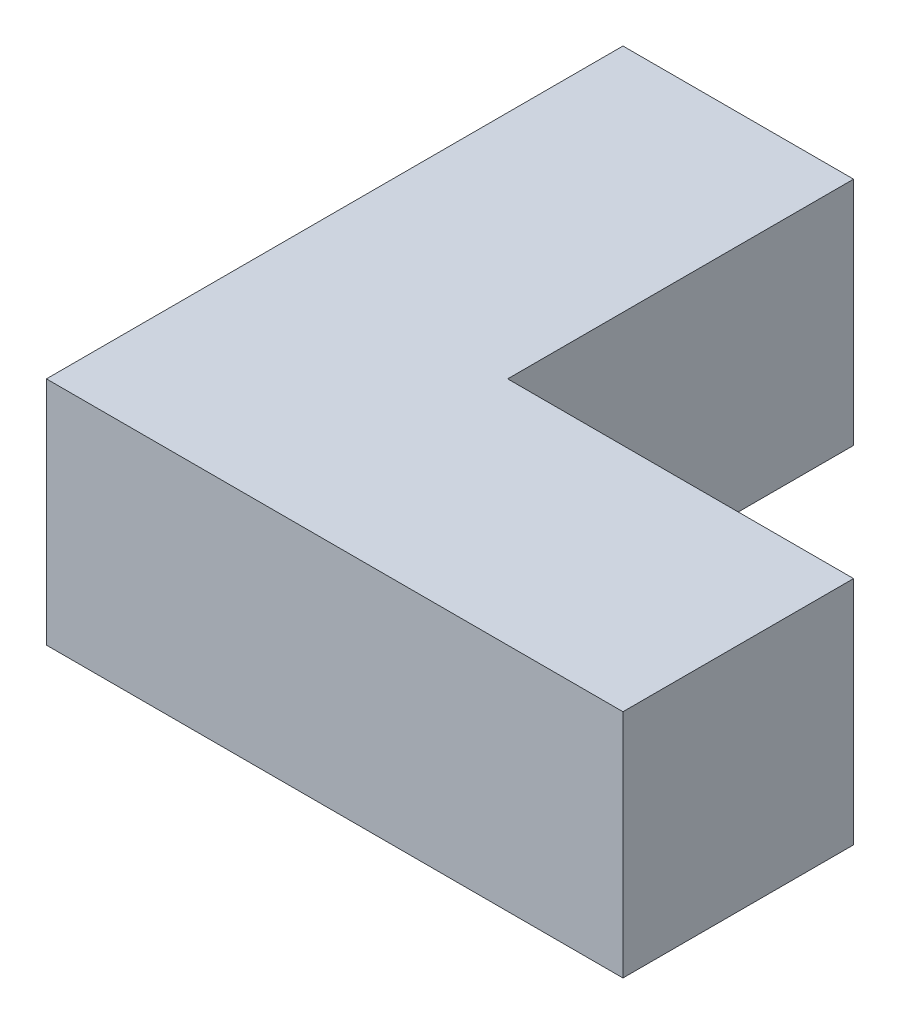
from build123d import *

# Parameters (mm, degrees)
SKETCH1_W           = 15
SKETCH1_H           = 10
SKETCH1_W_2         = 10
SKETCH1_H_2         = 15
BOSS_EXTRUDE2_DEPTH = 10


with BuildPart() as part:
    # Sketch1 → Boss-Extrude2 (new body)
    with BuildSketch(Plane(origin=(0, 0, 0), x_dir=(1, 0, 0), z_dir=(0, 1, 0))):
        with Locations((17.5, 5)):
            Rectangle(SKETCH1_W, SKETCH1_H)
        with Locations((5, 5)):
            Rectangle(SKETCH1_W_2, SKETCH1_H)
        with Locations((5, 17.5)):
            Rectangle(SKETCH1_W_2, SKETCH1_H_2)
    extrude(amount=-BOSS_EXTRUDE2_DEPTH)


solid = part.part
